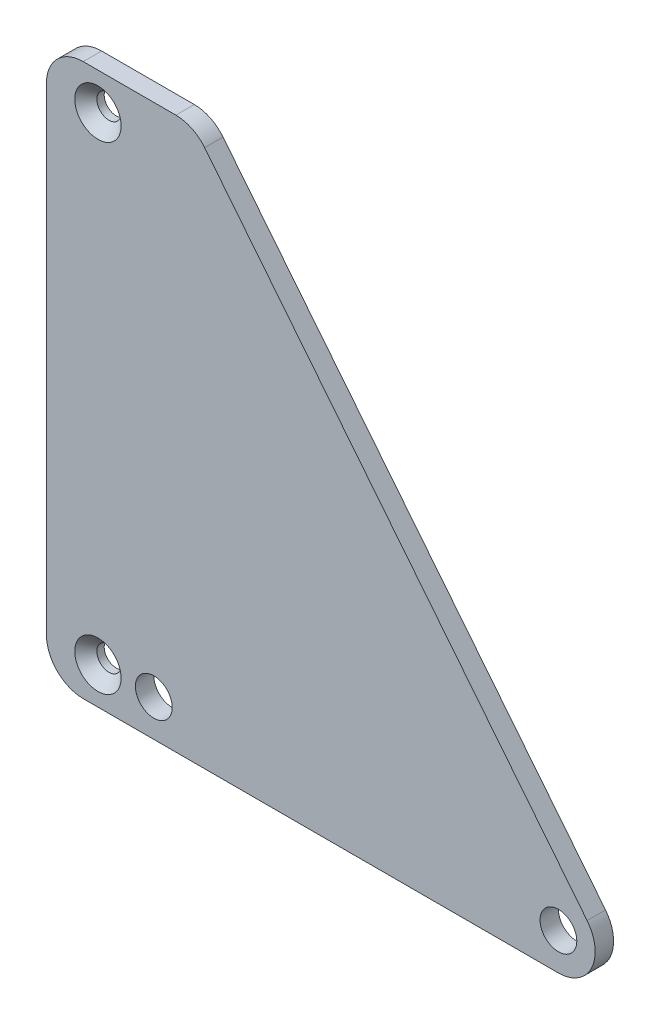
from build123d import *

# Parameters (mm, degrees)
EXTRUDE_410_DEPTH         = 2.5
HOLE_WIZARD_M6_AT_2_COUNT = 2
HOLE_WIZARD_M6_AT_2_PITCH = 130
FILLET_1_R                = 10
SKETCH_2_R                = 5
CUT_EXTRUDE_1_DEPTH       = 212.621774622


with BuildPart() as part:
    # Эскиз1 → Extrude 410 (new, symmetric)
    with BuildSketch(Plane.XY):
        Polygon((0, 0), (160, 0), (40, 150), (0, 150), align=None)
    extrude(amount=EXTRUDE_410_DEPTH, both=True)

    # Эскиз4 → Крепление-M6 (revolve, cut)
    with BuildSketch(Plane(origin=(14, 140, 2.5), x_dir=(0, -1, 0), z_dir=(1, 0, 0))):
        Polygon((0, 0), (0, 5), (3.3, 5), (3.3, 3), (6.3, 0), align=None)
    hole_wizard_m6 = revolve(axis=Axis((14, 140, 8.85), (0, 0, -1)), mode=Mode.SUBTRACT)

    # Крепление-M6 at 2: Крепление-M6 ×2
    with Locations(*[(0, -i * HOLE_WIZARD_M6_AT_2_PITCH, 0) for i in range(1, HOLE_WIZARD_M6_AT_2_COUNT)]):
        add(hole_wizard_m6, mode=Mode.SUBTRACT)

    # Скругление1
    fillet_1_edges = [part.edges().sort_by_distance(p)[0] for p in [
        (0, 150, 0),
        (40, 150, 0),
        (160, 0, 0),
        (0, 0, 0),
    ]]
    fillet(fillet_1_edges, radius=FILLET_1_R)

    # Эскиз2 → Вырез-Вытянуть1 (cut, through all)
    with BuildSketch(Plane.XY.offset(2.5)):
        with Locations((139.193751525, 10)):
            Circle(SKETCH_2_R)
        with Locations((29.193751525, 10)):
            Circle(SKETCH_2_R)
    extrude(amount=-CUT_EXTRUDE_1_DEPTH, mode=Mode.SUBTRACT)


solid = part.part
